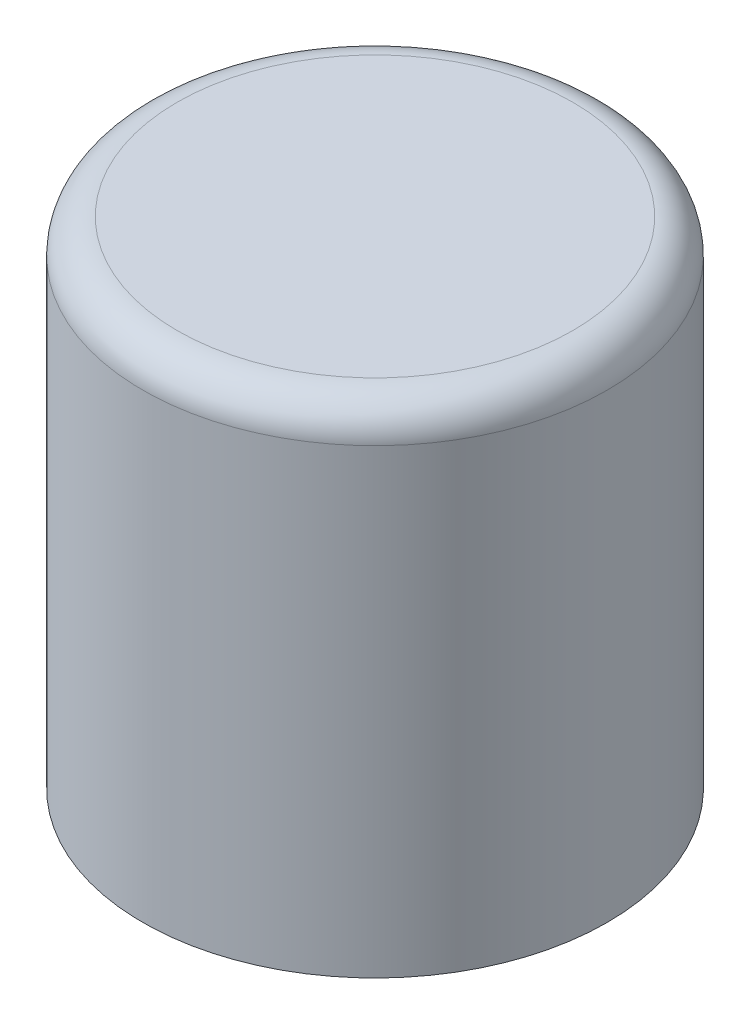
from build123d import *

# Parameters (mm, degrees)
CONG_1_R = 2


with BuildPart() as part:
    # Esquisse1 → Révolution1 (revolve)
    with BuildSketch(Plane.XY, mode=Mode.PRIVATE) as r_volution1_sk:
        Polygon((-13.5, 0), (-13.5, 28.8), (0, 28.8), (0, 25.8), (-12, 25.8), (-12, 3), (-12.5, 3), (-12.5, 2), (-12, 2), (-12, 0), align=None)
    revolve(r_volution1_sk.sketch.rotate(Axis((0, 0, 0), (0, 1, 0)), 180), axis=Axis((0, 0, 0), (0, 1, 0)))

    # Congé1
    cong_1_edges = [part.edges().sort_by_distance(p)[0] for p in [
        (-13.5, 28.8, 0),
    ]]
    fillet(cong_1_edges, radius=CONG_1_R)


solid = part.part
